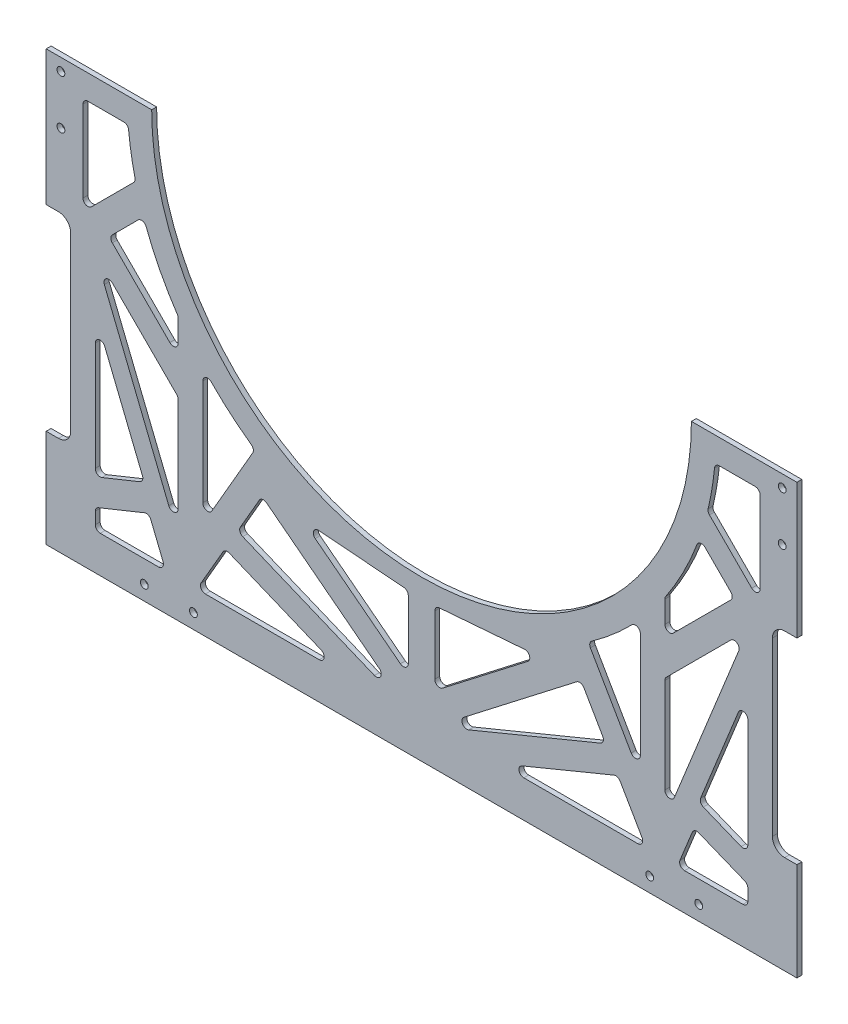
from build123d import *

# Parameters (mm, degrees)
SKETCH_1_W              = 306
SKETCH_1_H              = 175
EXTRUDE_1_DEPTH         = 2
SKETCH_2_R              = 110
SKETCH_2_W              = 10
SKETCH_2_H              = 80
CUT_EXTRUDE_1_DEPTH     = 177.264715698
FILLET_1_R              = 5
HOLE_WIZARD_3_2_3_2_1_D = 3.2
HOLE_WIZARD_3_2_3_2_2_D = 3.2
CUT_EXTRUDE_2_DEPTH     = 10
FILLET_2_R              = 2
FILLET_2_OF_MIRROR_3_R  = 2


with BuildPart() as part:
    # 草图1 → 凸台-拉伸1 (new body)
    with BuildSketch(Plane.XY):
        Rectangle(SKETCH_1_W, SKETCH_1_H)
    extrude(amount=EXTRUDE_1_DEPTH)

    # 草图2 → 切除-拉伸1 (cut, through all)
    with BuildSketch(Plane.XY.offset(2)):
        with Locations((0, 87.5)):
            Circle(SKETCH_2_R)
        with Locations((-148, -7.5)):
            Rectangle(SKETCH_2_W, SKETCH_2_H)
        with Locations((148, -7.5)):
            Rectangle(SKETCH_2_W, SKETCH_2_H)
    extrude(amount=-CUT_EXTRUDE_1_DEPTH, mode=Mode.SUBTRACT)

    # 圆角1
    fillet_1_edges = [part.edges().sort_by_distance(p)[0] for p in [
        (143, -47.5, 1),
        (143, 32.5, 1),
        (-143, 32.5, 1),
        (-143, -47.5, 1),
    ]]
    fillet(fillet_1_edges, radius=FILLET_1_R)

    # Ø3.2 (3.2) 直径孔1 (through all)
    with Locations(Plane(origin=(-147, 82.5, 2), x_dir=(1, 0, 0), z_dir=(0, 0, 1))):
        with Locations((0, 0), (0, -20)):
            hole_wizard_3_2_3_2_1 = Hole(HOLE_WIZARD_3_2_3_2_1_D / 2)

    # 镜向1: Ø3.2 (3.2) 直径孔1 across plane
    add(hole_wizard_3_2_3_2_1.mirror(Plane(origin=(0, 0, 0), x_dir=(0, 0, 1), z_dir=(1, 0, 0))), mode=Mode.SUBTRACT)

    # Ø3.2 (3.2) 直径孔2 (through all)
    with Locations(Plane(origin=(-113, -81.5, 2), x_dir=(1, 0, 0), z_dir=(0, 0, 1))):
        with Locations((0, 0), (20, 0)):
            hole_wizard_3_2_3_2_2 = Hole(HOLE_WIZARD_3_2_3_2_2_D / 2)

    # 镜向2: Ø3.2 (3.2) 直径孔2 across plane
    add(hole_wizard_3_2_3_2_2.mirror(Plane(origin=(0, 0, 0), x_dir=(0, 0, 1), z_dir=(1, 0, 0))), mode=Mode.SUBTRACT)

    # 草图7 → 切除-拉伸2 (cut)
    with BuildSketch(Plane.XY.offset(2)):
        with BuildLine():
            Line((-138, 77.5), (-138, 37.5))
            Line((-138, 37.5), (-116.553428589, 58.946571411))
            ThreePointArc((-116.553428589, 58.946571411), (-118.431897329, 68.163875903), (-119.582607431, 77.5))
            Line((-119.582607431, 77.5), (-138, 77.5))
        make_face()
        with BuildLine():
            Line((-127.46644704, 33.891417336), (-113.324311416, 48.03355296))
            ThreePointArc((-113.324311416, 48.03355296), (-107.177013369, 33.526971501), (-99.182175793, 19.950788272))
            Line((-99.182175793, 19.950788272), (-99.182175793, 5.607146089))
            Line((-99.182175793, 5.607146089), (-127.46644704, 33.891417336))
        make_face()
        Polygon((-133, 25.282834672), (-99.182175793, -8.534989535), (-99.182175793, -58.302319282), align=None)
        Polygon((-133, 3.952734845), (-133, -53.571693723), (-113, -45.479868176), align=None)
        Polygon((-133, -64.359159143), (-133, -72.5), (-104.225383435, -72.5), (-111.10343515, -55.5), align=None)
        with BuildLine():
            Line((-89.182175793, 7.209654871), (-89.182175793, -48.302319282))
            Line((-89.182175793, -48.302319282), (-67.900763938, -11.441832693))
            ThreePointArc((-67.900763938, -11.441832693), (-79.093185457, -2.74559831), (-89.182175793, 7.209654871))
        make_face()
        Polygon((-91.605707885, -72.5), (-80.058702502, -52.5), (-31.605707885, -72.5), align=None)
        Polygon((-75.014735912, -43.763593595), (-65.014735912, -26.44308552), (-5.396488671, -72.5), align=None)
        Polygon((-5.396488671, -59.863531439), (-5.396488671, -29.863531439), (-48.657493674, -26.44308552), align=None)
    cut_extrude_2 = extrude(amount=-CUT_EXTRUDE_2_DEPTH, mode=Mode.SUBTRACT)

    # 圆角2
    fillet_2_edges = [part.edges().sort_by_distance(p)[0] for p in [
        (-89.182175793, 7.209654871, 1),
        (-67.900763938, -11.441832693, 1),
        (-89.182175793, -48.302319282, 1),
        (-31.605707885, -72.5, 1),
        (-91.605707885, -72.5, 1),
        (-80.058702502, -52.5, 1),
        (-48.657493674, -26.44308552, 1),
        (-5.396488671, -29.863531439, 1),
        (-5.396488671, -59.863531439, 1),
        (-5.396488671, -72.5, 1),
        (-75.014735912, -43.763593595, 1),
        (-65.014735912, -26.44308552, 1),
        (-104.225383435, -72.5, 1),
        (-133, -72.5, 1),
        (-133, -64.359159143, 1),
        (-111.10343515, -55.5, 1),
        (-99.182175793, 5.607146089, 1),
        (-127.46644704, 33.891417336, 1),
        (-113.324311416, 48.03355296, 1),
        (-99.182175793, 19.950788272, 1),
        (-133, 3.952734845, 1),
        (-113, -45.479868176, 1),
        (-133, -53.571693723, 1),
        (-99.182175793, -58.302319282, 1),
        (-133, 25.282834672, 1),
        (-99.182175793, -8.534989535, 1),
        (-138, 77.5, 1),
        (-119.582607431, 77.5, 1),
        (-116.553428589, 58.946571411, 1),
        (-138, 37.5, 1),
    ]]
    fillet(fillet_2_edges, radius=FILLET_2_R)

    # 镜向3: 切除-拉伸2 across plane
    add(cut_extrude_2.mirror(Plane(origin=(0, 0, 0), x_dir=(0, 0, 1), z_dir=(1, 0, 0))), mode=Mode.SUBTRACT)

    # 圆角2 of 镜向3
    fillet_2_of_mirror_3_edges = [part.edges().sort_by_distance(p)[0] for p in [
        (89.182175793, 7.209654871, 1),
        (67.900763938, -11.441832693, 1),
        (89.182175793, -48.302319282, 1),
        (31.605707885, -72.5, 1),
        (91.605707885, -72.5, 1),
        (80.058702502, -52.5, 1),
        (48.657493674, -26.44308552, 1),
        (5.396488671, -29.863531439, 1),
        (5.396488671, -59.863531439, 1),
        (5.396488671, -72.5, 1),
        (75.014735912, -43.763593595, 1),
        (65.014735912, -26.44308552, 1),
        (104.225383435, -72.5, 1),
        (133, -72.5, 1),
        (133, -64.359159143, 1),
        (111.10343515, -55.5, 1),
        (99.182175793, 5.607146089, 1),
        (127.46644704, 33.891417336, 1),
        (113.324311416, 48.03355296, 1),
        (99.182175793, 19.950788272, 1),
        (133, 3.952734845, 1),
        (113, -45.479868176, 1),
        (133, -53.571693723, 1),
        (99.182175793, -58.302319282, 1),
        (133, 25.282834672, 1),
        (99.182175793, -8.534989535, 1),
        (138, 77.5, 1),
        (119.582607431, 77.5, 1),
        (116.553428589, 58.946571411, 1),
        (138, 37.5, 1),
    ]]
    fillet(fillet_2_of_mirror_3_edges, radius=FILLET_2_OF_MIRROR_3_R)


solid = part.part
